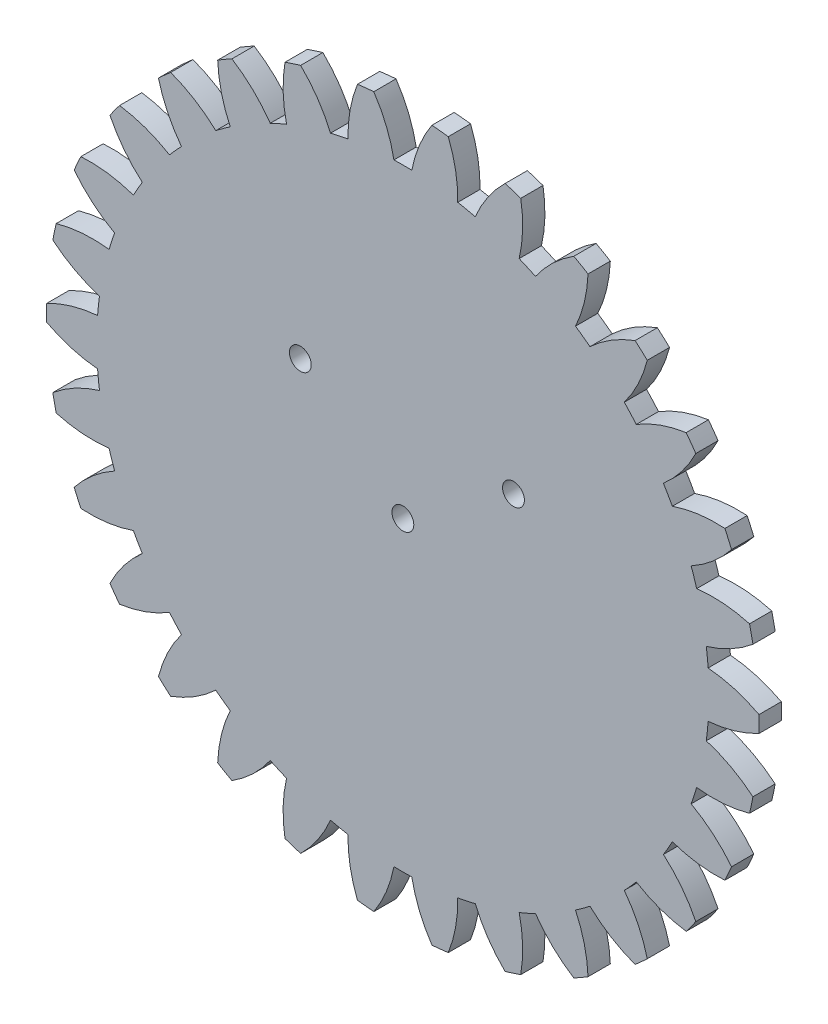
from build123d import *

# Parameters (mm, degrees)
SKETCH1_R           = 48
BOSS_EXTRUDE1_DEPTH = 3
CUT_EXTRUDE1_DEPTH  = 68.948509917
CIRPATTERN1_COUNT   = 30
SKETCH7_R           = 1.47
CUT_EXTRUDE2_DEPTH  = 68.835567074
SKETCH8_R           = 1.47
CUT_EXTRUDE3_DEPTH  = 68.835567074


with BuildPart() as part:
    # Sketch1 → Boss-Extrude1 (new body)
    with BuildSketch(Plane.XY):
        Circle(SKETCH1_R)
    extrude(amount=BOSS_EXTRUDE1_DEPTH)

    # Sketch2 → Cut-Extrude1 (cut, through all)
    with BuildSketch(Plane.XY.offset(3)):
        with BuildLine():
            ThreePointArc((-1.20388032, 41.232428648), (0, 41.25), (1.20388032, 41.232428648))
            ThreePointArc((1.20388032, 41.232428648), (2.228958391, 44.672086233), (3.916100076, 47.839984952))
            ThreePointArc((3.916100076, 47.839984952), (0, 48), (-3.916100076, 47.839984952))
            ThreePointArc((-3.916100076, 47.839984952), (-2.228958391, 44.672086233), (-1.20388032, 41.232428648))
        make_face()
    cut_extrude1 = extrude(amount=-CUT_EXTRUDE1_DEPTH, mode=Mode.SUBTRACT)

    # CirPattern1: Cut-Extrude1 ×30 about axis
    cirpattern1_axis = Axis((0, 0, 0), (0, 0, 1))
    for i in range(1, CIRPATTERN1_COUNT):
        add(cut_extrude1.rotate(cirpattern1_axis, i * 360 / CIRPATTERN1_COUNT), mode=Mode.SUBTRACT)

    # Sketch7 → Cut-Extrude2 (cut, through all)
    with BuildSketch(Plane(origin=(0, 0, 0), x_dir=(-1, 0, 0), z_dir=(0, 0, -1))):
        Circle(SKETCH7_R)
    extrude(amount=-CUT_EXTRUDE2_DEPTH, mode=Mode.SUBTRACT)

    # Sketch8 → Cut-Extrude3 (cut, through all)
    with BuildSketch(Plane(origin=(0, 0, 0), x_dir=(-1, 0, 0), z_dir=(0, 0, -1))):
        with Locations((-14.906326969, 10.311015532)):
            Circle(SKETCH8_R)
        with Locations((13.81771751, 11.729719)):
            Circle(SKETCH8_R)
    extrude(amount=-CUT_EXTRUDE3_DEPTH, mode=Mode.SUBTRACT)


solid = part.part
